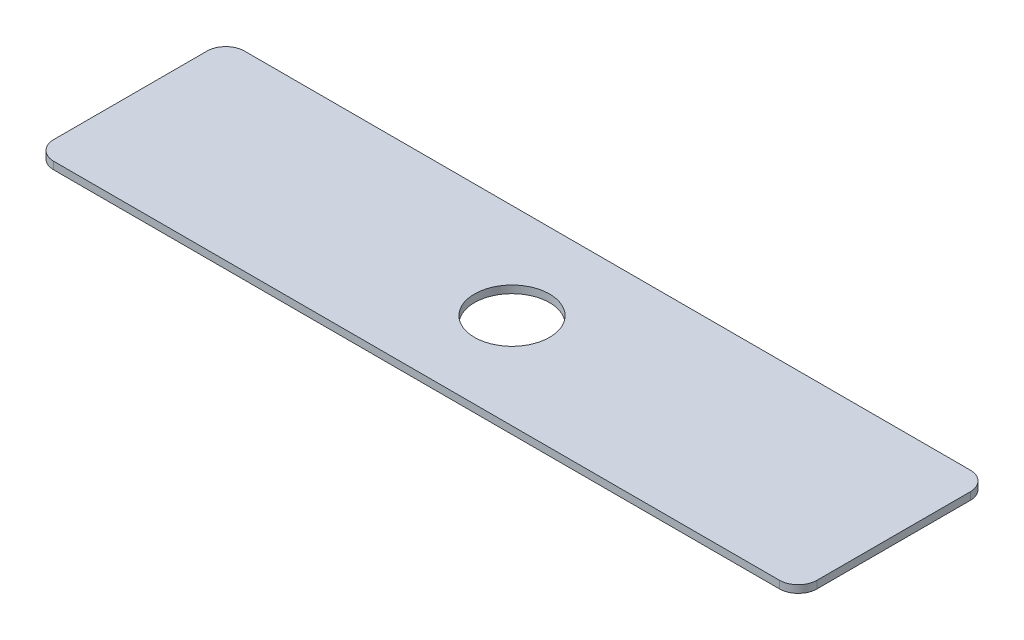
from build123d import *

# Parameters (mm, degrees)
SKETCH2_W               = 203.2
SKETCH2_H               = 50.8
BOSS_EXTRUDE1_DEPTH     = 1
FILLET1_R               = 5
CUT_EXTRUDE1_DEPTH      = 105.731657105
CUT_EXTRUDE1_DEPTH_BACK = 105.731657105
SKETCH3_R               = 10


with BuildPart() as part:
    # Sketch2 → Boss-Extrude1 (new, symmetric)
    with BuildSketch(Plane(origin=(0, 0, 0), x_dir=(1, 0, 0), z_dir=(0, 1, 0))):
        Rectangle(SKETCH2_W, SKETCH2_H)
    extrude(amount=BOSS_EXTRUDE1_DEPTH, both=True)

    # Fillet1
    fillet1_edges = [part.edges().sort_by_distance(p)[0] for p in [
        (101.6, 0, 25.4),
        (-101.6, 0, 25.4),
        (-101.6, 0, -25.4),
        (101.6, 0, -25.4),
    ]]
    fillet(fillet1_edges, radius=FILLET1_R)

    # Sketch3 → Cut-Extrude1 (cut, two sides: drawn at the far end of the back side and taken through both)
    with BuildSketch(Plane(origin=(0, 0, 0), x_dir=(1, 0, 0), z_dir=(0, 1, 0)).offset(-CUT_EXTRUDE1_DEPTH_BACK)):
        with Locations(Location((0, 0, 0), (0, 0, 270))):
            Circle(SKETCH3_R)
    extrude(amount=CUT_EXTRUDE1_DEPTH + CUT_EXTRUDE1_DEPTH_BACK, mode=Mode.SUBTRACT)


solid = part.part
